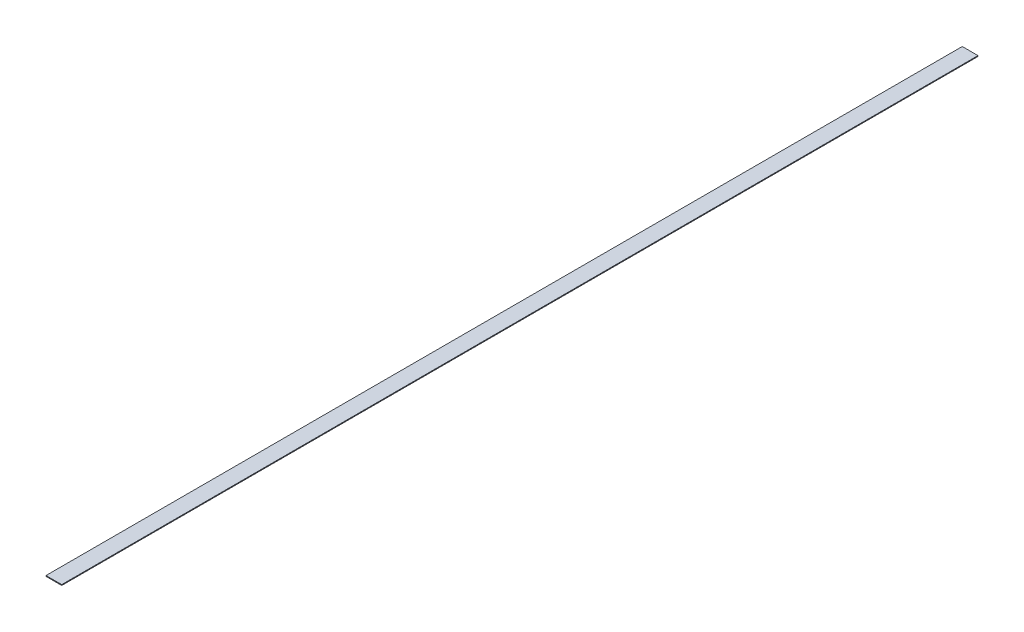
from build123d import *

# Parameters (mm, degrees)
SKETCH1_W           = 50.8
SKETCH1_H           = 2959.1
BOSS_EXTRUDE1_DEPTH = 2.54


with BuildPart() as part:
    # Sketch1 → Boss-Extrude1 (new body)
    with BuildSketch(Plane(origin=(0, 0, 0), x_dir=(1, 0, 0), z_dir=(0, 1, 0))):
        Rectangle(SKETCH1_W, SKETCH1_H)
    extrude(amount=BOSS_EXTRUDE1_DEPTH)


solid = part.part
